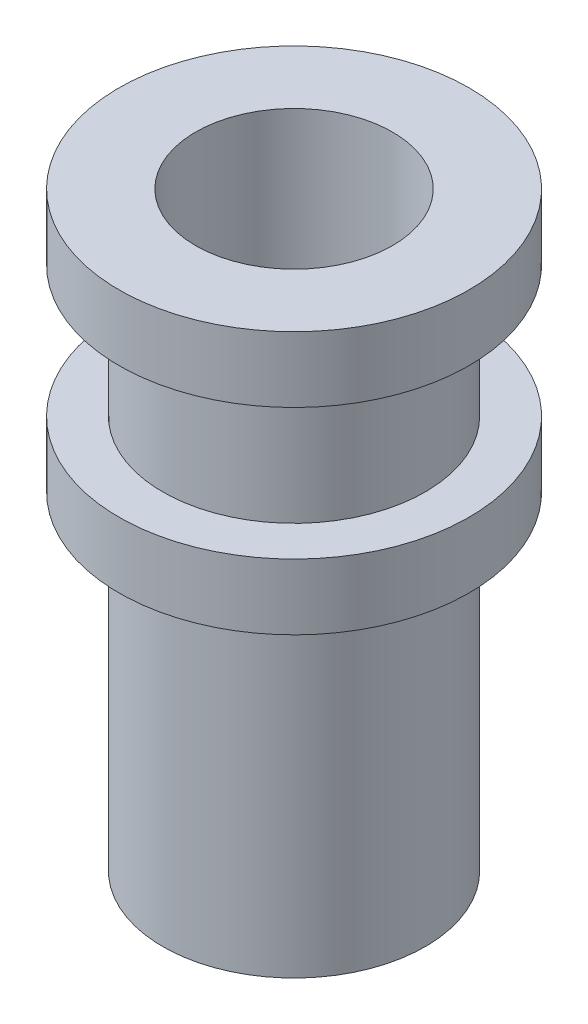
from build123d import *

# Parameters (mm, degrees)
SKETCH_2_R          = 2250
SKETCH_2_R_2        = 900
CUT_EXTRUDE_1_DEPTH = 5000
SKETCH_3_R          = 900
CUT_EXTRUDE_3_DEPTH = 29275.562336609
SKETCH_4_R          = 4500
CUT_EXTRUDE_4_DEPTH = 8000
CHAMFER_1_SIZE      = 3000


with BuildPart() as part:
    # 草圖1 → 旋轉1 (revolve)
    with BuildSketch(Plane.XY, mode=Mode.PRIVATE) as revolve_1_sk:
        Polygon((0, 0), (0, 14972.865629195), (-8000, 14972.865629195), (-8000, 11972.865629195), (-6000, 11972.865629195), (-6000, 5972.865629195), (-8000, 5972.865629195), (-8000, 2972.865629195), (-6000, 2972.865629195), (-6000, -12027.134370805), (0, -12027.134370805), align=None)
    revolve(revolve_1_sk.sketch.rotate(Axis((0, 0, 0), (0, 1, 0)), 270), axis=Axis((0, 0, 0), (0, 1, 0)))

    # 草圖2 → 除料-伸長1 (cut)
    with BuildSketch(Plane.XZ.offset(12027.134370805)):
        with Locations(Location((0, 0, 0), (0, 0, 270))):
            Circle(SKETCH_2_R)
        with Locations(Location((0, 0, 0), (0, 0, 270))):
            Circle(SKETCH_2_R_2, mode=Mode.SUBTRACT)
    extrude(amount=-CUT_EXTRUDE_1_DEPTH, mode=Mode.SUBTRACT)

    # 草圖3 → 除料-伸長3 (cut, through all)
    with BuildSketch(Plane.XZ.offset(12027.134370805)):
        with Locations(Location((0, 0, 0), (0, 0, 270))):
            Circle(SKETCH_3_R)
    extrude(amount=-CUT_EXTRUDE_3_DEPTH, mode=Mode.SUBTRACT)

    # 草圖4 → 除料-伸長4 (cut)
    with BuildSketch(Plane(origin=(0, 14972.865629195, 0), x_dir=(1, 0, 0), z_dir=(0, 1, 0))):
        with Locations(Location((0, 0, 0), (0, 0, 270))):
            Circle(SKETCH_4_R)
    extrude(amount=-CUT_EXTRUDE_4_DEPTH, mode=Mode.SUBTRACT)

    # 導角1
    chamfer_1_edges = [part.edges().sort_by_distance(p)[0] for p in [
        (0, 6972.865629195, 900),
    ]]
    chamfer(chamfer_1_edges, length=CHAMFER_1_SIZE)


solid = part.part
